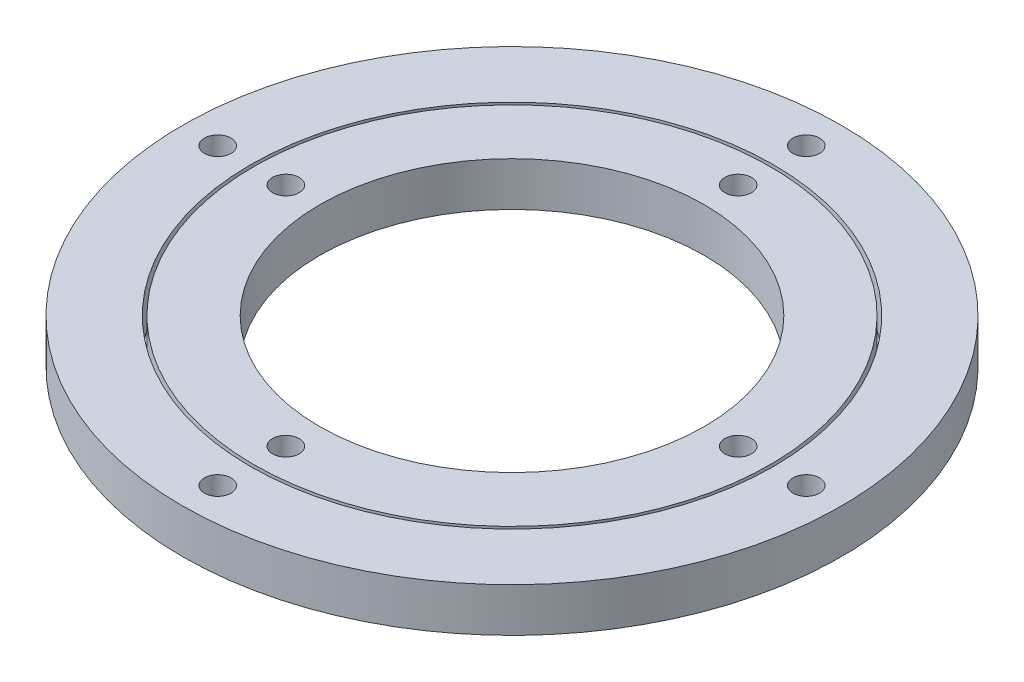
from build123d import *

# Parameters (mm, degrees)
SKETCH_1_R          = 60
SKETCH_1_R_2        = 35
EXTRUDE_1_DEPTH     = 8
SKETCH_2_R          = 47.6
SKETCH_2_R_2        = 47
CUT_EXTRUDE_1_DEPTH = 7.5
SKETCH_3_R          = 2.425
CUT_EXTRUDE_2_DEPTH = 86.229103011
SKETCH_4_R          = 2.425
CUT_EXTRUDE_3_DEPTH = 86.229103011


with BuildPart() as part:
    # 草图1 → 凸台-拉伸1 (new body)
    with BuildSketch(Plane(origin=(0, 0, 0), x_dir=(1, 0, 0), z_dir=(0, 1, 0))):
        with Locations(Location((0, 0, 0), (0, 0, 270))):
            Circle(SKETCH_1_R)
        with Locations(Location((0, 0, 0), (0, 0, 270))):
            Circle(SKETCH_1_R_2, mode=Mode.SUBTRACT)
    extrude(amount=EXTRUDE_1_DEPTH)

    # 草图2 → 切除-拉伸1 (cut)
    with BuildSketch(Plane(origin=(0, 8, 0), x_dir=(1, 0, 0), z_dir=(0, 1, 0))):
        with Locations(Location((0, 0, 0), (0, 0, 270))):
            Circle(SKETCH_2_R)
        with Locations(Location((0, 0, 0), (0, 0, 270))):
            Circle(SKETCH_2_R_2, mode=Mode.SUBTRACT)
    extrude(amount=-CUT_EXTRUDE_1_DEPTH, mode=Mode.SUBTRACT)

    # 草图3 → 切除-拉伸2 (cut, through all)
    with BuildSketch(Plane(origin=(0, 8, 0), x_dir=(1, 0, 0), z_dir=(0, 1, 0))):
        with BuildLine():
            ThreePointArc((-43.6, 0), (-41.175, -2.425), (-38.75, 0))
            Line((-38.75, 0), (-43.6, 0))
        make_face()
        with BuildLine():
            Line((-43.6, 0), (-38.75, 0))
            ThreePointArc((-38.75, 0), (-41.175, 2.425), (-43.6, 0))
        make_face()
        with Locations(Location((0, 41.175, 0), (0, 0, 270))):
            Circle(SKETCH_3_R)
        with BuildLine():
            ThreePointArc((43.6, 0), (41.175, 2.425), (38.75, 0))
            Line((38.75, 0), (43.6, 0))
        make_face()
        with BuildLine():
            Line((43.6, 0), (38.75, 0))
            ThreePointArc((38.75, 0), (41.175, -2.425), (43.6, 0))
        make_face()
        with Locations(Location((0, -41.175, 0), (0, 0, 270))):
            Circle(SKETCH_3_R)
    extrude(amount=-CUT_EXTRUDE_2_DEPTH, mode=Mode.SUBTRACT)

    # 草图4 → 切除-拉伸3 (cut, through all)
    with BuildSketch(Plane(origin=(0, 8, 0), x_dir=(1, 0, 0), z_dir=(0, 1, 0))):
        with Locations(Location((0, 53.575, 0), (0, 0, 270))):
            Circle(SKETCH_4_R)
        with Locations(Location((53.575, 0, 0), (0, 0, 270))):
            Circle(SKETCH_4_R)
        with Locations(Location((0, -53.575, 0), (0, 0, 270))):
            Circle(SKETCH_4_R)
        with BuildLine():
            ThreePointArc((-56, 0), (-53.575, -2.425), (-51.15, 0))
            Line((-51.15, 0), (-56, 0))
        make_face()
        with BuildLine():
            Line((-56, 0), (-51.15, 0))
            ThreePointArc((-51.15, 0), (-53.575, 2.425), (-56, 0))
        make_face()
    extrude(amount=-CUT_EXTRUDE_3_DEPTH, mode=Mode.SUBTRACT)


solid = part.part
